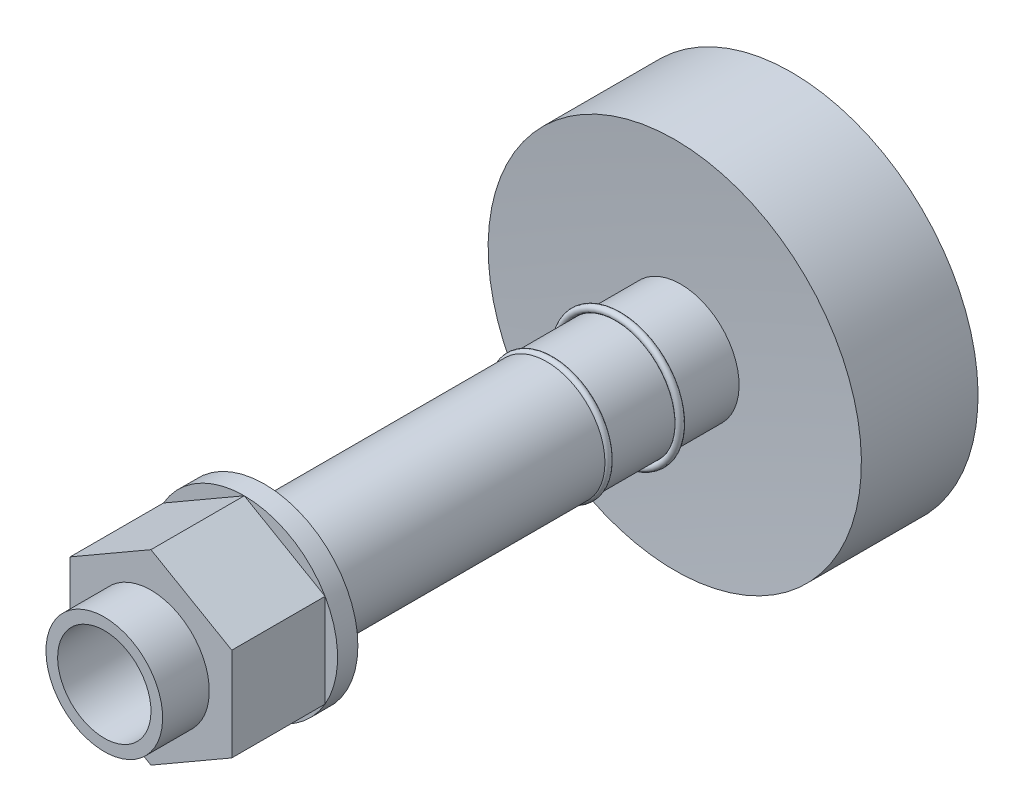
from build123d import *

# Parameters (mm, degrees)
SKETCH1_W          = 20
SKETCH1_H          = 5
SKETCH2_R          = 47.475732925
CUT_EXTRUDE1_DEPTH = 40
SKETCH3_W          = 3
SKETCH3_H          = 2
SKETCH3_W_2        = 2
SKETCH3_H_2        = 3
SKETCH4_W          = 2
SKETCH4_H          = 3
SKETCH5_R          = 1.5
SKETCH5_R_2        = 1.464909104
SKETCH5_R_3        = 1.4
SKETCH5_R_4        = 1.438808622


with BuildPart() as part:
    # Sketch1 → Revolve1 (revolve)
    with BuildSketch(Plane(origin=(0, 0, 0), x_dir=(0, 0, -1), z_dir=(1, 0, 0))):
        with BuildLine():
            Line((-127.667859858, 25), (-127.667859858, 20))
            Line((-127.667859858, 20), (146.850396264, 20))
            Line((146.850396264, 20), (146.850396264, 80))
            Line((146.850396264, 80), (96.850396264, 80))
            ThreePointArc((96.850396264, 80), (98.479302627, 52.515867606), (99.432140142, 25))
            Line((99.432140142, 25), (-77.667859858, 25))
            ThreePointArc((-77.667859858, 25), (-78.286578918, 32.502589449), (-78.965178016, 40))
            Line((-78.965178016, 40), (-127.667859858, 40))
            Line((-127.667859858, 40), (-127.667859858, 25))
        make_face()
        with Locations((-137.667859858, 22.5)):
            Rectangle(SKETCH1_W, SKETCH1_H)
    revolve(axis=Axis((0, 0, -146.850396264), (0, 0, 1)))

    # Sketch2 → Cut-Extrude1 (cut)
    with BuildSketch(Plane.XY.offset(127.667859858)):
        Circle(SKETCH2_R)
        Polygon((34.641016151, -20), (34.641016151, 20), (0, 40), (-34.641016151, 20), (-34.641016151, -20), (0, -40), align=None, mode=Mode.SUBTRACT)
    extrude(amount=-CUT_EXTRUDE1_DEPTH, mode=Mode.SUBTRACT)

    # Sketch3 → Cut-Revolve1 (revolve, cut)
    with BuildSketch(Plane(origin=(0, 0, 0), x_dir=(1, 0, 0), z_dir=(0, 1, 0))):
        with Locations((26.5, 97.850396264)):
            Rectangle(SKETCH3_W, SKETCH3_H)
        with Locations((24, 43.430612265)):
            Rectangle(SKETCH3_W_2, SKETCH3_H_2)
        with Locations((26.5, -78.667859858)):
            Rectangle(SKETCH3_W, SKETCH3_H)
    revolve(axis=Axis((0, 0, 0), (0, 0, -1)), mode=Mode.SUBTRACT)

    # Sketch4 → Cut-Revolve2 (revolve, cut)
    with BuildSketch(Plane(origin=(0, 0, 0), x_dir=(1, 0, 0), z_dir=(0, 1, 0)), mode=Mode.PRIVATE) as cut_revolve2_sk:
        with Locations((20.998754541, -92.205859438)):
            Rectangle(SKETCH4_W, SKETCH4_H)
        with Locations((20.998754541, 86.224989527)):
            Rectangle(SKETCH4_W, SKETCH4_H)
    revolve(cut_revolve2_sk.sketch.rotate(Axis((0, 0, -154.641449096), (0, 0, 1)), 180), axis=Axis((0, 0, -154.641449096), (0, 0, 1)), mode=Mode.SUBTRACT)


with BuildPart() as body_2:
    # Sketch5 → Revolve2 (revolve)
    with BuildSketch(Plane(origin=(0, 0, 0), x_dir=(1, 0, 0), z_dir=(0, 1, 0)), mode=Mode.PRIVATE) as revolve2_sk:
        with Locations((24.5, 43.430612265)):
            Circle(SKETCH5_R)
        with Locations((26.503158442, 72.508881384)):
            Circle(SKETCH5_R_2)
        with Locations((20.492344319, 86.242107482)):
            Circle(SKETCH5_R_3)
        with Locations((26.503158442, -77.264793694)):
            Circle(SKETCH5_R_4)
        with Locations((20.492344319, -92.249545542)):
            Circle(SKETCH5_R_3)
    revolve(revolve2_sk.sketch.rotate(Axis((0, 0, -162.722824805), (0, 0, 1)), 270), axis=Axis((0, 0, -162.722824805), (0, 0, 1)))


solid = Compound([part.part, body_2.part])
